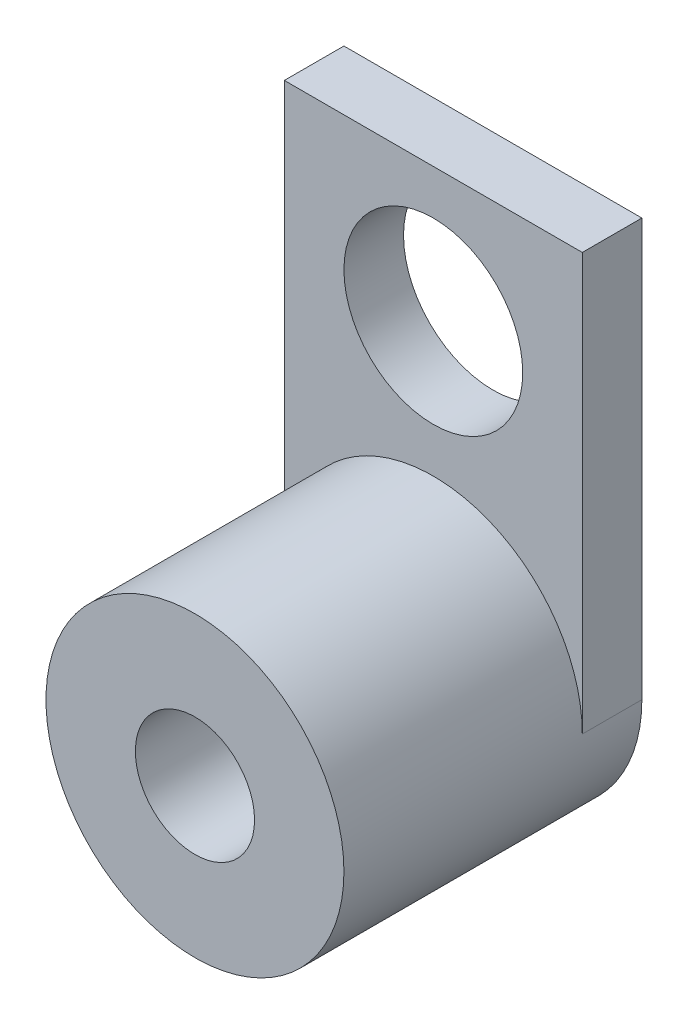
from build123d import *

# Parameters (mm, degrees)
SKETCH3_R           = 63.5
SKETCH3_R_2         = 25.4
BOSS_EXTRUDE1_DEPTH = 127
SKETCH4_R           = 25.4
SKETCH4_R_2         = 38.1
BOSS_EXTRUDE2_DEPTH = 25.4


with BuildPart() as part:
    # Sketch3 → Boss-Extrude1 (new body)
    with BuildSketch(Plane(origin=(0, 0, 0), x_dir=(0, 1, 0), z_dir=(0, 0, 1))):
        with Locations(Location((0, 0, 0), (0, 0, 270))):
            Circle(SKETCH3_R)
        with Locations(Location((0, 0, 0), (0, 0, 270))):
            Circle(SKETCH3_R_2, mode=Mode.SUBTRACT)
    extrude(amount=BOSS_EXTRUDE1_DEPTH)

    # Sketch4 → Boss-Extrude2 (add)
    with BuildSketch(Plane(origin=(0, 0, 0), x_dir=(0, 1, 0), z_dir=(0, 0, 1))):
        with BuildLine():
            Line((0, 63.5), (177.8, 63.5))
            Line((177.8, 63.5), (177.8, -63.5))
            Line((177.8, -63.5), (0, -63.5))
            ThreePointArc((0, -63.5), (-63.5, 0), (0, 63.5))
        make_face()
        with Locations(Location((0, 0, 0), (0, 0, 270))):
            Circle(SKETCH4_R, mode=Mode.SUBTRACT)
        with Locations(Location((120.65, 0, 0), (0, 0, 270))):
            Circle(SKETCH4_R_2, mode=Mode.SUBTRACT)
    extrude(amount=BOSS_EXTRUDE2_DEPTH)


solid = part.part
